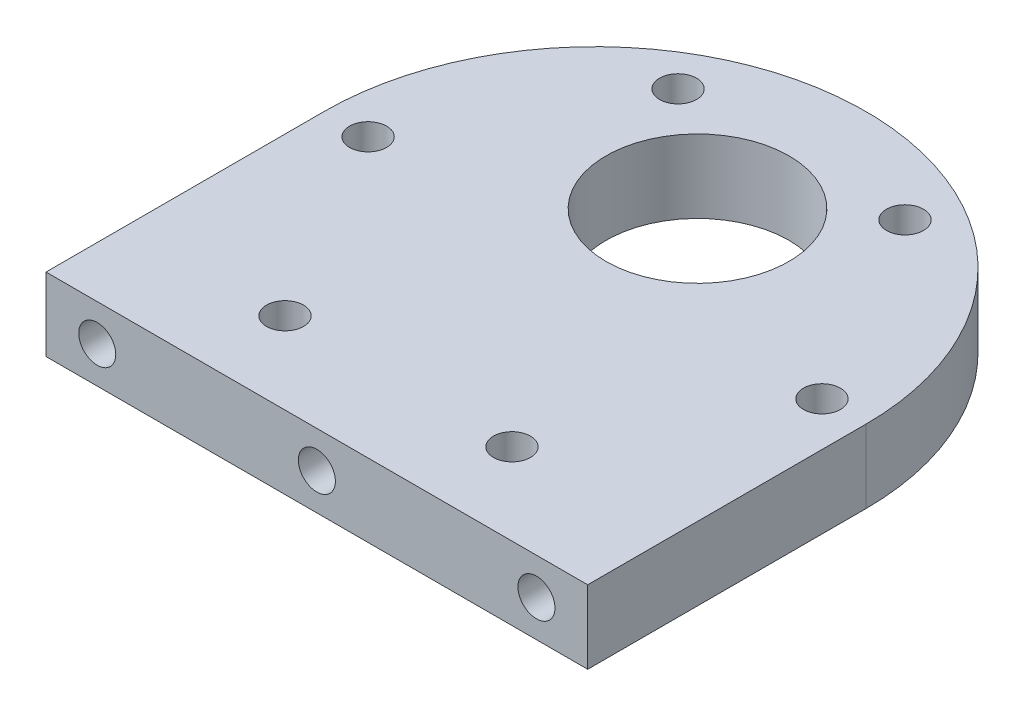
from build123d import *

# Parameters (mm, degrees)
ESBO_O2_R                = 1.265
RESSALTO_EXTRUS_O1_DEPTH = 5
ESBO_O3_R                = 6.25
CORTE_EXTRUS_O1_DEPTH    = 5
ESBO_O4_R                = 1.265
CORTE_EXTRUS_O2_DEPTH    = 12


with BuildPart() as part:
    # Esboço2 → Ressalto-extrusão1 (new body)
    with BuildSketch(Plane(origin=(0, 0, 0), x_dir=(1, 0, 0), z_dir=(0, 1, 0))):
        with BuildLine():
            Line((0, 0), (37, 0))
            Line((37, 0), (37, 19))
            ThreePointArc((37, 19), (18.5, 37.5), (0, 19))
            Line((0, 19), (0, 0))
        make_face()
        with Locations(Location((10.75, 32.423393759, 0), (0, 0, 270))):
            Circle(ESBO_O2_R, mode=Mode.SUBTRACT)
        with Locations(Location((26.25, 32.423393759, 0), (0, 0, 270))):
            Circle(ESBO_O2_R, mode=Mode.SUBTRACT)
        with Locations(Location((34, 19, 0), (0, 0, 270))):
            Circle(ESBO_O2_R, mode=Mode.SUBTRACT)
        with Locations(Location((26.25, 5.576606241, 0), (0, 0, 270))):
            Circle(ESBO_O2_R, mode=Mode.SUBTRACT)
        with Locations(Location((10.75, 5.576606241, 0), (0, 0, 270))):
            Circle(ESBO_O2_R, mode=Mode.SUBTRACT)
        with Locations(Location((3, 19, 0), (0, 0, 270))):
            Circle(ESBO_O2_R, mode=Mode.SUBTRACT)
    extrude(amount=RESSALTO_EXTRUS_O1_DEPTH)

    # Esboço3 → Corte-extrusão1 (cut)
    with BuildSketch(Plane.XZ):
        with Locations(Location((18.5, -26, 0), (0, 0, 270))):
            Circle(ESBO_O3_R)
    extrude(amount=-CORTE_EXTRUS_O1_DEPTH, mode=Mode.SUBTRACT)

    # Esboço4 → Corte-extrusão2 (cut)
    with BuildSketch(Plane.XY):
        with Locations((3.5, 2.5)):
            Circle(ESBO_O4_R)
        with Locations((18.5, 2.5)):
            Circle(ESBO_O4_R)
        with Locations((33.5, 2.5)):
            Circle(ESBO_O4_R)
    extrude(amount=-CORTE_EXTRUS_O2_DEPTH, mode=Mode.SUBTRACT)


solid = part.part
